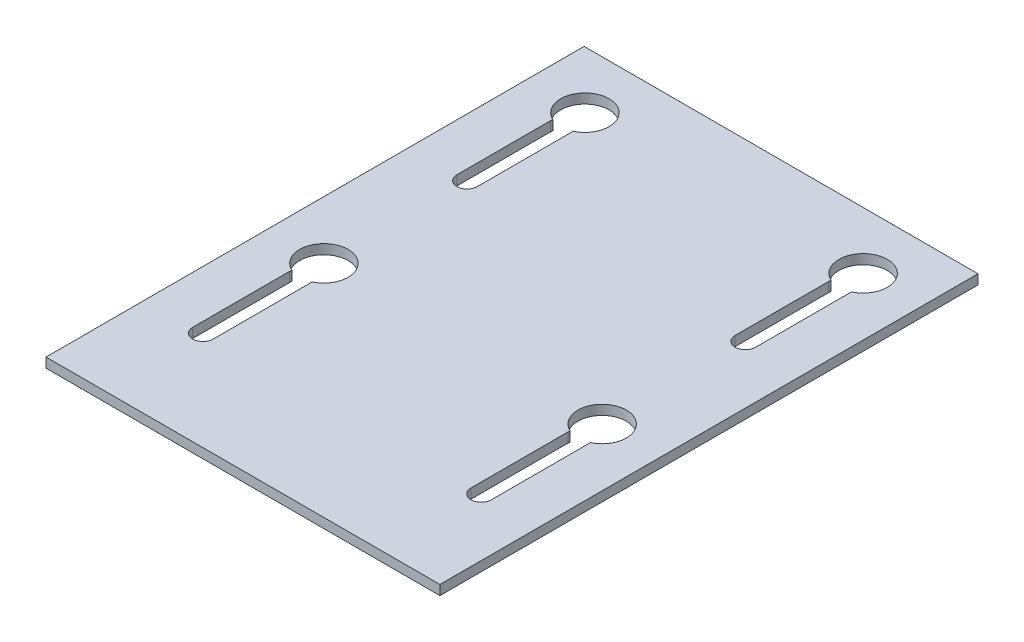
from build123d import *

# Parameters (mm, degrees)
SKETCH3_W           = 122.1
SKETCH3_H           = 197.8
BOSS_EXTRUDE2_DEPTH = 3
SKETCH4_R           = 7.5
CUT_EXTRUDE2_DEPTH  = 3
SKETCH5_W           = 185.639017853
SKETCH5_H           = 93.814581834
CUT_EXTRUDE3_DEPTH  = 12
SKETCH7_W           = 181.97184254
SKETCH7_H           = 161.609726855
CUT_EXTRUDE4_DEPTH  = 19


with BuildPart() as part:
    # Sketch3 → Boss-Extrude2 (new body)
    with BuildSketch(Plane(origin=(0, 0, 0), x_dir=(1, 0, 0), z_dir=(0, 1, 0))):
        with Locations((61.05, 98.9)):
            Rectangle(SKETCH3_W, SKETCH3_H)
    extrude(amount=BOSS_EXTRUDE2_DEPTH)

    # Sketch4 → Cut-Extrude2 (cut)
    with BuildSketch(Plane(origin=(0, 3, 0), x_dir=(1, 0, 0), z_dir=(0, 1, 0))):
        with Locations((17.92, 168.12)):
            Circle(SKETCH4_R)
        with Locations((17.92, 87.22)):
            Circle(SKETCH4_R)
        with Locations((104.18, 87.22)):
            Circle(SKETCH4_R)
        with Locations((104.18, 168.12)):
            Circle(SKETCH4_R)
        with BuildLine():
            Line((21.08772899, 160.62), (21.08772899, 131.62))
            ThreePointArc((21.08772899, 131.62), (17.92, 128.45227101), (14.75227101, 131.62))
            Line((14.75227101, 131.62), (14.75227101, 160.62))
            ThreePointArc((14.75227101, 160.62), (17.92, 163.78772899), (21.08772899, 160.62))
        make_face()
        with BuildLine():
            Line((21.085, 79.72), (21.085, 49.72))
            ThreePointArc((21.085, 49.72), (17.92, 46.555), (14.755, 49.72))
            Line((14.755, 49.72), (14.755, 79.72))
            ThreePointArc((14.755, 79.72), (17.92, 82.885), (21.085, 79.72))
        make_face()
        with BuildLine():
            Line((101.015, 79.72), (101.015, 49.72))
            ThreePointArc((101.015, 49.72), (104.18, 46.555), (107.345, 49.72))
            Line((107.345, 49.72), (107.345, 79.72))
            ThreePointArc((107.345, 79.72), (104.18, 82.885), (101.015, 79.72))
        make_face()
        with BuildLine():
            Line((101.01227101, 160.62), (101.01227101, 131.62))
            ThreePointArc((101.01227101, 131.62), (104.18, 128.45227101), (107.34772899, 131.62))
            Line((107.34772899, 131.62), (107.34772899, 160.62))
            ThreePointArc((107.34772899, 160.62), (104.18, 163.78772899), (101.01227101, 160.62))
        make_face()
    extrude(amount=-CUT_EXTRUDE2_DEPTH, mode=Mode.SUBTRACT)

    # Sketch5 → Cut-Extrude3 (cut)
    with BuildSketch(Plane(origin=(0, 0, -197.8), x_dir=(-1, 0, 0), z_dir=(0, 0, -1))):
        with Locations((-62.393879106, -6.143731482)):
            Rectangle(SKETCH5_W, SKETCH5_H)
    extrude(amount=-CUT_EXTRUDE3_DEPTH, mode=Mode.SUBTRACT)

    # Sketch7 → Cut-Extrude4 (cut)
    with BuildSketch(Plane.XY):
        with Locations((66.543858185, 9.384028943)):
            Rectangle(SKETCH7_W, SKETCH7_H)
    extrude(amount=-CUT_EXTRUDE4_DEPTH, mode=Mode.SUBTRACT)


solid = part.part
